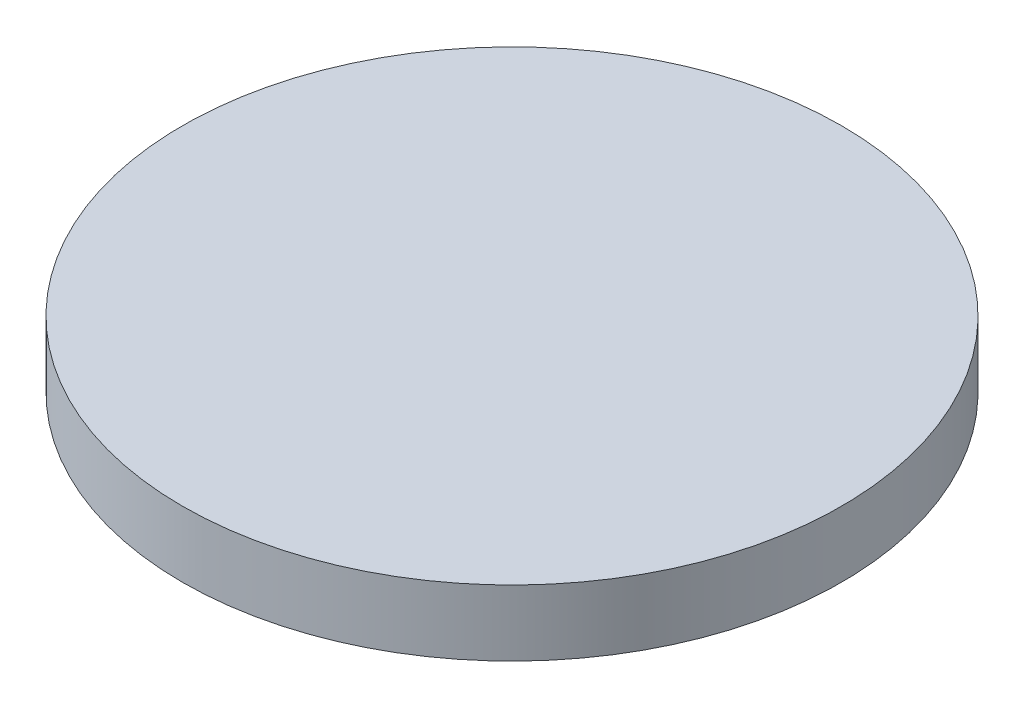
from build123d import *

# Parameters (mm, degrees)
SKETCH_1_R      = 250
EXTRUDE_1_DEPTH = 50


with BuildPart() as part:
    # 草图1 → 凸台-拉伸1 (new body)
    with BuildSketch(Plane(origin=(0, 0, 0), x_dir=(1, 0, 0), z_dir=(0, 1, 0))):
        with Locations(Location((0, 0, 0), (0, 0, 270))):
            Circle(SKETCH_1_R)
    extrude(amount=EXTRUDE_1_DEPTH)


solid = part.part
